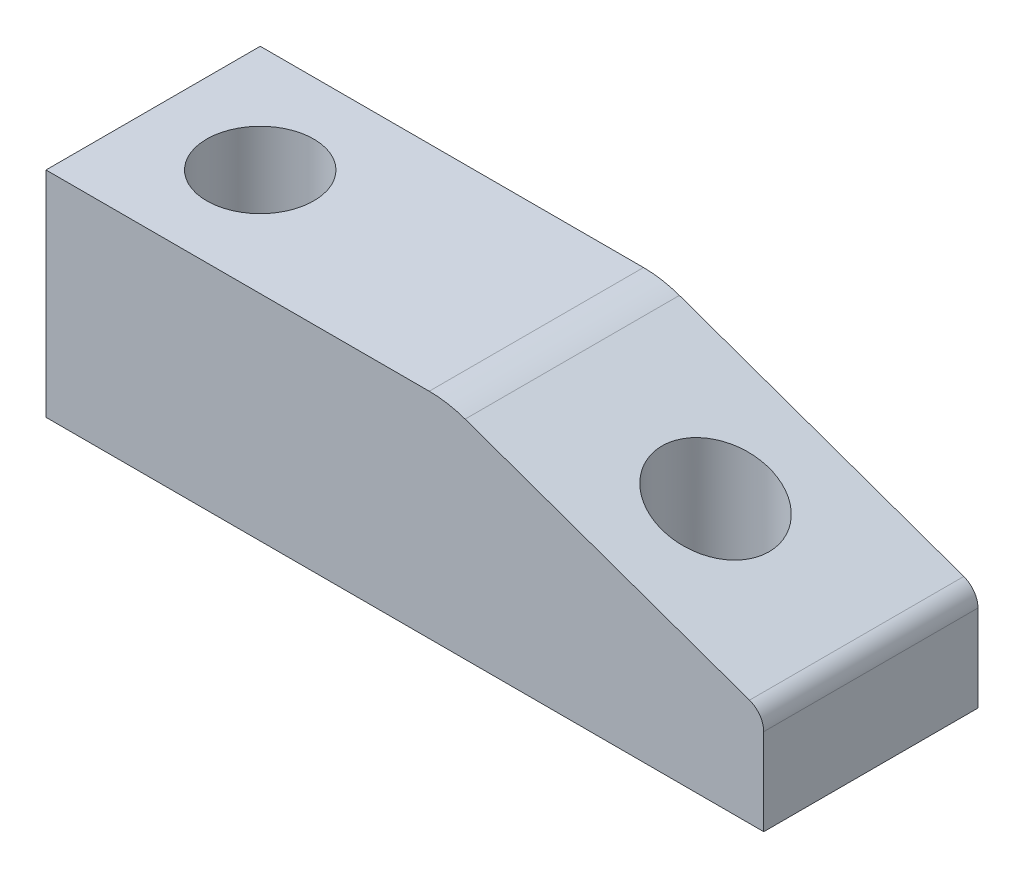
from build123d import *

# Parameters (mm, degrees)
BOSS_EXTRUDE1_DEPTH = 40
SKETCH2_R           = 6
CUT_EXTRUDE1_DEPTH  = 40
SKETCH2_3_R         = 10
CUT_EXTRUDE2_DEPTH  = 29


with BuildPart() as part:
    # Sketch1 → Boss-Extrude1 (new body)
    with BuildSketch(Plane.XY):
        with BuildLine():
            Line((-27.793358166, 28.276724623), (-27.793358166, -11.723275377))
            Line((-27.793358166, -11.723275377), (106.206641834, -11.723275377))
            Line((106.206641834, -11.723275377), (106.206641834, 4.454631522))
            ThreePointArc((106.206641834, 4.454631522), (105.475066122, 6.760580931), (103.547940496, 8.223042049))
            Line((103.547940496, 8.223042049), (50.459922528, 27.118777258))
            ThreePointArc((50.459922528, 27.118777258), (47.156291785, 27.985111831), (43.753429217, 28.276724623))
            Line((43.753429217, 28.276724623), (-27.793358166, 28.276724623))
        make_face()
    extrude(amount=-BOSS_EXTRUDE1_DEPTH)

    # Sketch2 → Cut-Extrude1 (cut)
    with BuildSketch(Plane(origin=(0, 28.276724623, 0), x_dir=(1, 0, 0), z_dir=(0, 1, 0))):
        with Locations(Location((-7.793358166, 20, 0), (0, 0, 180))):
            Circle(SKETCH2_R)
        with Locations(Location((77.206641834, 20, 0), (0, 0, 180))):
            Circle(SKETCH2_R)
    extrude(amount=-CUT_EXTRUDE1_DEPTH, mode=Mode.SUBTRACT)

    # Sketch2<3> → Cut-Extrude2 (cut)
    with BuildSketch(Plane(origin=(0, 28.276724623, 0), x_dir=(1, 0, 0), z_dir=(0, 1, 0))):
        with Locations(Location((-7.793358166, 20, 0), (0, 0, 180))):
            Circle(SKETCH2_3_R)
        with Locations(Location((77.206641834, 20, 0), (0, 0, 180))):
            Circle(SKETCH2_3_R)
    extrude(amount=-CUT_EXTRUDE2_DEPTH, mode=Mode.SUBTRACT)


solid = part.part
